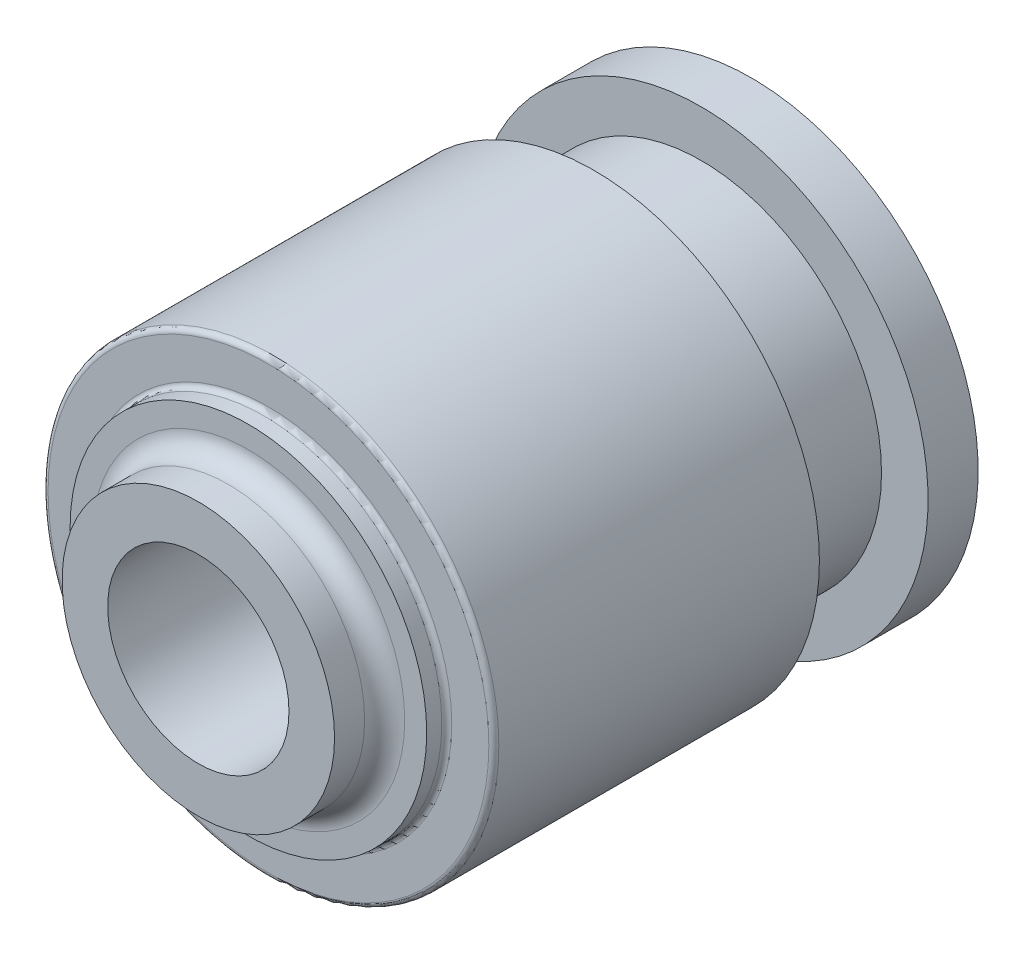
from build123d import *

# Parameters (mm, degrees)
IZIM1_R                     = 22.5
Y_KSEKLIK_EKSTR_ZYON1_DEPTH = 32.5
IZIM2_R                     = 17.8
Y_KSEKLIK_EKSTR_ZYON2_DEPTH = 2
RADYUS1_R                   = 0.5
IZIM3_R                     = 13.6
Y_KSEKLIK_EKSTR_ZYON3_DEPTH = 5
RADYUS2_R                   = 2
IZIM4_R                     = 9.05
KES_EKSTR_ZYON1_DEPTH       = 20
RADYUS3_R                   = 0.5
IZIM5_R                     = 18
Y_KSEKLIK_EKSTR_ZYON4_DEPTH = 10.7
IZIM6_R                     = 22.65
Y_KSEKLIK_EKSTR_ZYON5_DEPTH = 5
IZIM7_W                     = 16
IZIM7_H                     = 16
IZIM7_W_2                   = 13
IZIM7_H_2                   = 13
Y_KSEKLIK_EKSTR_ZYON6_DEPTH = 4


with BuildPart() as part:
    # Çizim1 → Yükseklik-Ekstrüzyon1 (new body)
    with BuildSketch(Plane.XY):
        Circle(IZIM1_R)
    extrude(amount=Y_KSEKLIK_EKSTR_ZYON1_DEPTH)

    # Çizim2 → Yükseklik-Ekstrüzyon2 (add)
    with BuildSketch(Plane.XY.offset(32.5)):
        Circle(IZIM2_R)
    extrude(amount=Y_KSEKLIK_EKSTR_ZYON2_DEPTH)

    # Radyus1
    radyus1_edges = [part.edges().sort_by_distance(p)[0] for p in [
        (-17.8, 0, 32.5),
    ]]
    fillet(radyus1_edges, radius=RADYUS1_R)

    # Çizim3 → Yükseklik-Ekstrüzyon3 (add)
    with BuildSketch(Plane.XY.offset(34.5)):
        Circle(IZIM3_R)
    extrude(amount=Y_KSEKLIK_EKSTR_ZYON3_DEPTH)

    # Radyus2
    radyus2_edges = [part.edges().sort_by_distance(p)[0] for p in [
        (-13.6, 0, 34.5),
    ]]
    fillet(radyus2_edges, radius=RADYUS2_R)

    # Çizim4 → Kes-Ekstrüzyon1 (cut)
    with BuildSketch(Plane.XY.offset(39.5)):
        Circle(IZIM4_R)
    extrude(amount=-KES_EKSTR_ZYON1_DEPTH, mode=Mode.SUBTRACT)

    # Radyus3
    radyus3_edges = [part.edges().sort_by_distance(p)[0] for p in [
        (-22.5, 0, 32.5),
    ]]
    fillet(radyus3_edges, radius=RADYUS3_R)

    # Çizim5 → Yükseklik-Ekstrüzyon4 (add)
    with BuildSketch(Plane(origin=(0, 0, 0), x_dir=(-1, 0, 0), z_dir=(0, 0, -1))):
        Circle(IZIM5_R)
    extrude(amount=Y_KSEKLIK_EKSTR_ZYON4_DEPTH)

    # Çizim6 → Yükseklik-Ekstrüzyon5 (add)
    with BuildSketch(Plane(origin=(0, 0, -10.7), x_dir=(-1, 0, 0), z_dir=(0, 0, -1))):
        Circle(IZIM6_R)
    extrude(amount=Y_KSEKLIK_EKSTR_ZYON5_DEPTH)

    # Çizim7 → Yükseklik-Ekstrüzyon6 (add)
    with BuildSketch(Plane(origin=(0, 0, -15.7), x_dir=(-1, 0, 0), z_dir=(0, 0, -1))):
        Rectangle(IZIM7_W, IZIM7_H)
        Rectangle(IZIM7_W_2, IZIM7_H_2, mode=Mode.SUBTRACT)
    extrude(amount=Y_KSEKLIK_EKSTR_ZYON6_DEPTH)


solid = part.part
